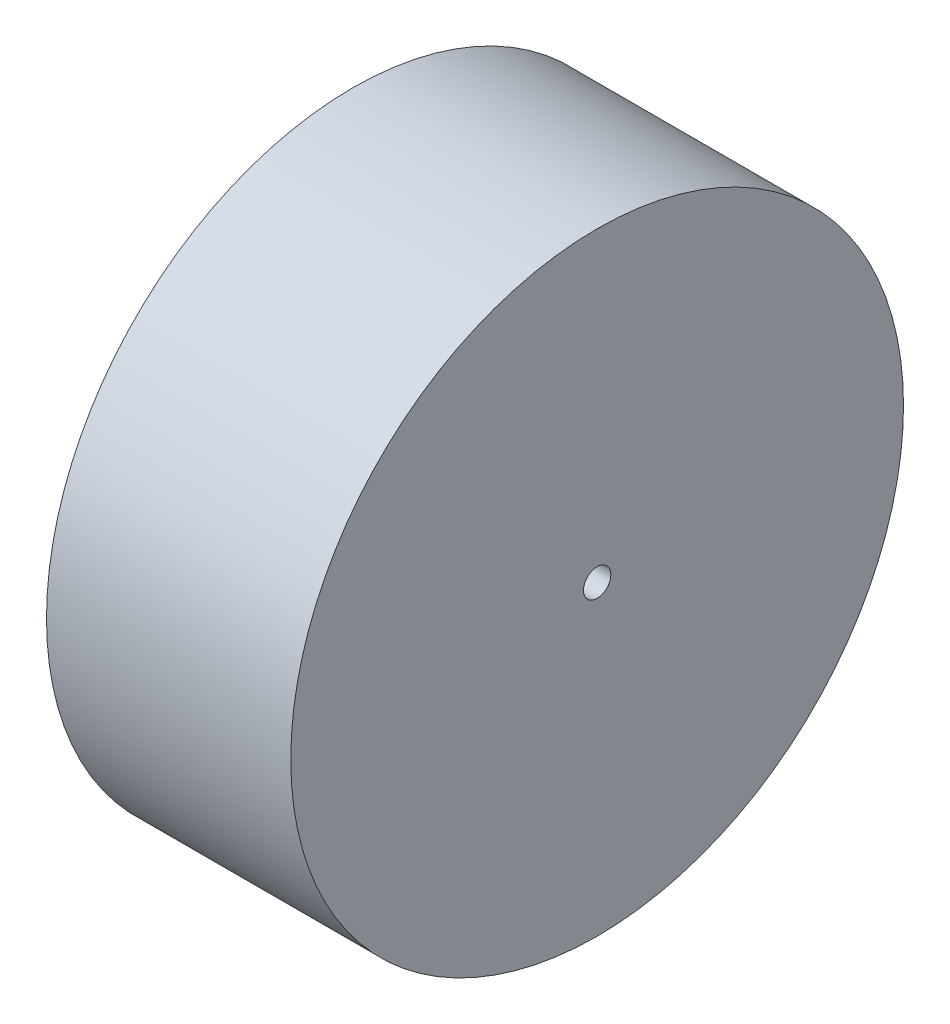
from build123d import *

# Parameters (mm, degrees)
BOSS_EXTRU_4_DEPTH      = 13.05
BOSS_EXTRU_4_DEPTH_BACK = 13.05
ESQUISSE1_R             = 32.735
ESQUISSE1_R_2           = 1.46


with BuildPart() as part:
    # Esquisse1 → Boss.-Extru.4 (new, two sides: drawn at the far end of the back side and taken through both)
    with BuildSketch(Plane(origin=(0, 0, 0), x_dir=(0, 0, -1), z_dir=(1, 0, 0)).offset(-BOSS_EXTRU_4_DEPTH_BACK)):
        Circle(ESQUISSE1_R)
        Circle(ESQUISSE1_R_2, mode=Mode.SUBTRACT)
    extrude(amount=BOSS_EXTRU_4_DEPTH + BOSS_EXTRU_4_DEPTH_BACK)


solid = part.part
